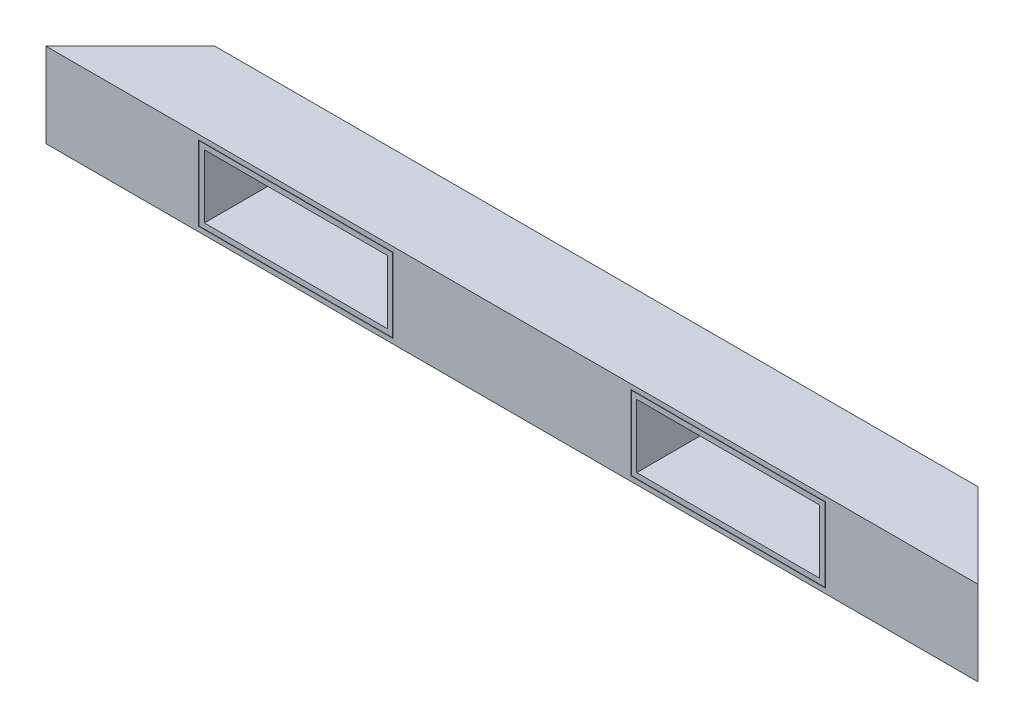
from build123d import *

# Parameters (mm, degrees)
CROQUIS1_W              = 1120.95
CROQUIS1_H              = 101.6
SALIENTE_EXTRUIR1_DEPTH = 101.6
CROQUIS3_W              = 88.9
CROQUIS3_H              = 88.9
CORTAR_EXTRUIR1_DEPTH   = 1120.95
CORTAR_EXTRUIR2_DEPTH   = 101.6
CORTAR_EXTRUIR3_REACH   = 1132.121
CROQUIS5_W              = 220
CROQUIS5_H              = 76.2
CROQUIS6_W              = 232.7
CROQUIS6_H              = 88.9
CROQUIS6_W_2            = 220
CROQUIS6_H_2            = 76.2
SALIENTE_EXTRUIR2_DEPTH = 101.6
CORTAR_EXTRUIR4_REACH   = 1132.121
CROQUIS7_W              = 233.7
CROQUIS7_H              = 89.9
CROQUIS7_W_2            = 232.7
CROQUIS7_H_2            = 88.9


with BuildPart() as part:
    # Croquis1 → Saliente-Extruir1 (new body)
    with BuildSketch(Plane.XY):
        with Locations((560.475, 50.8)):
            Rectangle(CROQUIS1_W, CROQUIS1_H)
    extrude(amount=-SALIENTE_EXTRUIR1_DEPTH)

    # Croquis3 → Cortar-Extruir1 (cut)
    with BuildSketch(Plane(origin=(1120.95, 0, 0), x_dir=(0, 0, -1), z_dir=(1, 0, 0))):
        with Locations((50.8, 50.8)):
            Rectangle(CROQUIS3_W, CROQUIS3_H)
    extrude(amount=-CORTAR_EXTRUIR1_DEPTH, mode=Mode.SUBTRACT)

    # Croquis4 → Cortar-Extruir2 (cut)
    with BuildSketch(Plane(origin=(0, 101.6, 0), x_dir=(1, 0, 0), z_dir=(0, 1, 0))):
        Polygon((1120.95, 101.6), (1019.35, 101.6), (1120.95, 0), align=None)
        Polygon((101.6, 101.6), (0, 101.6), (0, 0), align=None)
    extrude(amount=-CORTAR_EXTRUIR2_DEPTH, mode=Mode.SUBTRACT)

    # Cortar-Extruir3: up to this face of the body (flat: up to its plane)
    cortar_extruir3_end = Plane(part.part.faces().sort_by_distance((560.475, 50.8, -101.6))[0])
    # Croquis5 → Cortar-Extruir3 (cut, up to the picked face)
    with BuildSketch(Plane.XY, mode=Mode.PRIVATE) as cortar_extruir3_sk1:
        with Locations((300.475, 50.8)):
            Rectangle(CROQUIS5_W, CROQUIS5_H)
    cortar_extruir3_tool1 = split(extrude(cortar_extruir3_sk1.sketch, amount=-CORTAR_EXTRUIR3_REACH, mode=Mode.PRIVATE), bisect_by=cortar_extruir3_end, keep=Keep.BOTH, mode=Mode.PRIVATE)
    # Croquis5 → Cortar-Extruir3 (cut, up to the picked face)
    with BuildSketch(Plane.XY, mode=Mode.PRIVATE) as cortar_extruir3_sk2:
        with Locations((820.475, 50.8)):
            Rectangle(CROQUIS5_W, CROQUIS5_H)
    cortar_extruir3_tool2 = split(extrude(cortar_extruir3_sk2.sketch, amount=-CORTAR_EXTRUIR3_REACH, mode=Mode.PRIVATE), bisect_by=cortar_extruir3_end, keep=Keep.BOTH, mode=Mode.PRIVATE)
    add(cortar_extruir3_tool1.solids().sort_by(Axis((300.475, 50.8, 0), (0, 0, -1)))[0], mode=Mode.SUBTRACT)
    add(cortar_extruir3_tool2.solids().sort_by(Axis((820.475, 50.8, 0), (0, 0, -1)))[0], mode=Mode.SUBTRACT)

    # Croquis6 → Saliente-Extruir2 (add)
    # profile 1 of 2: a face of its own
    with BuildSketch(Plane.XY):
        with Locations((300.475, 50.8)):
            Rectangle(CROQUIS6_W, CROQUIS6_H)
        with Locations((300.475, 50.8)):
            Rectangle(CROQUIS6_W_2, CROQUIS6_H_2, mode=Mode.SUBTRACT)
    # profile 2 of 2: a face of its own
    with BuildSketch(Plane.XY):
        with Locations((820.475, 50.8)):
            Rectangle(CROQUIS6_W, CROQUIS6_H)
        with Locations((820.475, 50.8)):
            Rectangle(CROQUIS6_W_2, CROQUIS6_H_2, mode=Mode.SUBTRACT)
    extrude(amount=-SALIENTE_EXTRUIR2_DEPTH)

    # Cortar-Extruir4: up to this face of the body (flat: up to its plane)
    cortar_extruir4_end = Plane(part.part.faces().sort_by_distance((560.475, 50.8, -101.6))[0])
    # Croquis7 → Cortar-Extruir4 (cut, up to the picked face)
    with BuildSketch(Plane.XY, mode=Mode.PRIVATE) as cortar_extruir4_sk1:
        with Locations((300.475, 50.8)):
            Rectangle(CROQUIS7_W, CROQUIS7_H)
        with Locations((300.475, 50.8)):
            Rectangle(CROQUIS7_W_2, CROQUIS7_H_2, mode=Mode.SUBTRACT)
    cortar_extruir4_tool1 = split(extrude(cortar_extruir4_sk1.sketch, amount=-CORTAR_EXTRUIR4_REACH, mode=Mode.PRIVATE), bisect_by=cortar_extruir4_end, keep=Keep.BOTH, mode=Mode.PRIVATE)
    # Croquis7 → Cortar-Extruir4 (cut, up to the picked face)
    with BuildSketch(Plane.XY, mode=Mode.PRIVATE) as cortar_extruir4_sk2:
        with Locations((820.475, 50.8)):
            Rectangle(CROQUIS7_W, CROQUIS7_H)
        with Locations((820.475, 50.8)):
            Rectangle(CROQUIS7_W_2, CROQUIS7_H_2, mode=Mode.SUBTRACT)
    cortar_extruir4_tool2 = split(extrude(cortar_extruir4_sk2.sketch, amount=-CORTAR_EXTRUIR4_REACH, mode=Mode.PRIVATE), bisect_by=cortar_extruir4_end, keep=Keep.BOTH, mode=Mode.PRIVATE)
    add(cortar_extruir4_tool1.solids().sort_by(Axis((300.475, 6.100395, 0), (0, 0, -1)))[0], mode=Mode.SUBTRACT)
    add(cortar_extruir4_tool2.solids().sort_by(Axis((820.475, 6.100395, 0), (0, 0, -1)))[0], mode=Mode.SUBTRACT)


with BuildPart() as cortar_extruir4_piece_1:
    # of the separate pieces the step leaves, piece 1, a body of its own (cortar_extruir4_pieces)
    add(part.part.solids().sort_by_distance((0, 0, 0))[0])


with BuildPart() as cortar_extruir4_piece_2:
    # of the separate pieces the step leaves, piece 2, a body of its own (cortar_extruir4_pieces)
    add(part.part.solids().sort_by_distance((936.825, 95.25, 0))[0])


with BuildPart() as cortar_extruir4_piece_3:
    # of the separate pieces the step leaves, piece 3, a body of its own (cortar_extruir4_pieces)
    add(part.part.solids().sort_by_distance((416.825, 95.25, 0))[0])


solid = Compound([cortar_extruir4_piece_1.part, cortar_extruir4_piece_2.part, cortar_extruir4_piece_3.part])
